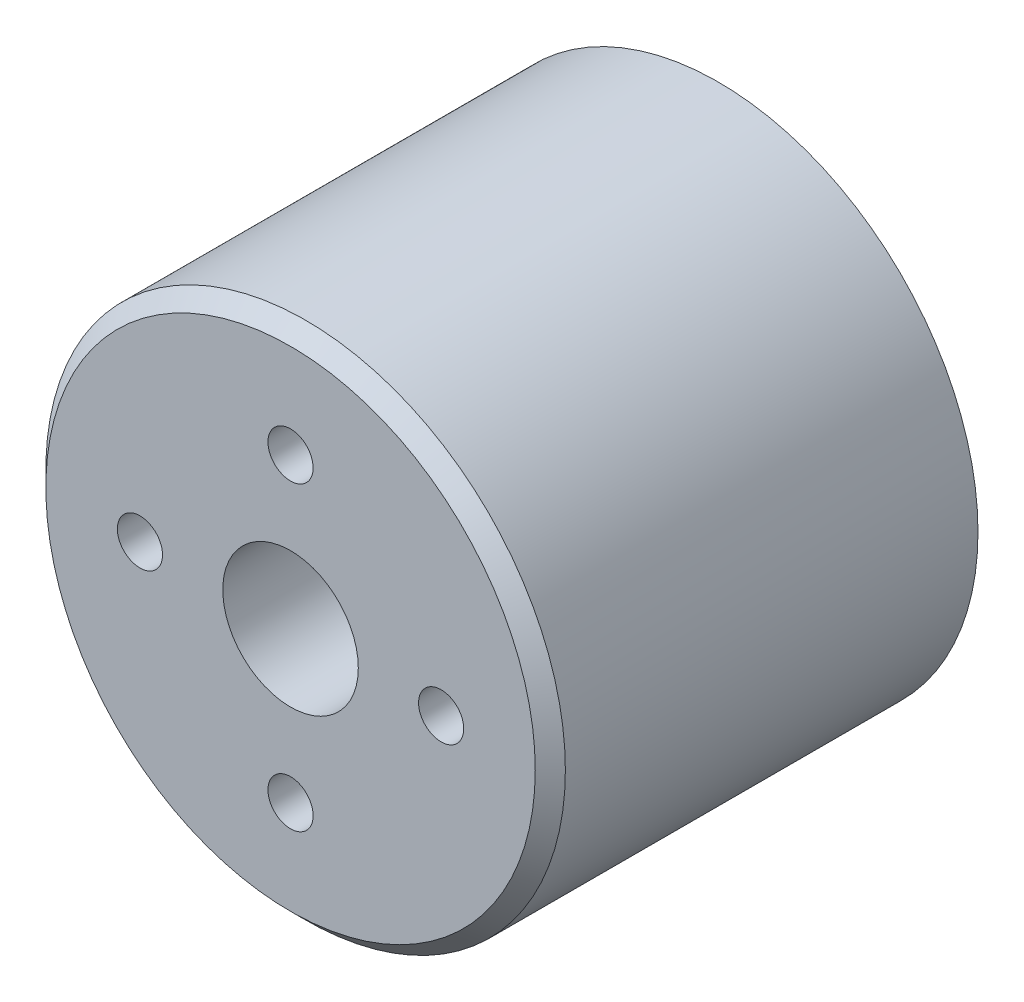
from build123d import *

# Parameters (mm, degrees)
ESQUISSE1_R             = 17.25
BOSS_EXTRU_1_DEPTH      = 28.4
CHANFREIN1_SIZE         = 1
ESQUISSE2_R             = 1.5
ESQUISSE2_R_2           = 1.25
ENL_V_MAT_EXTRU_1_DEPTH = 3
ENL_V_START             = -2.5
ESQUISSE3_R             = 1.5
ENL_V_MAT_EXTRU_2_DEPTH = 2.5
ESQUISSE4_R             = 4.5
ENL_V_MAT_EXTRU_4_DEPTH = 38.439083856


with BuildPart() as part:
    # Esquisse1 → Boss.-Extru.1 (new body)
    with BuildSketch(Plane.XY):
        Circle(ESQUISSE1_R)
    extrude(amount=BOSS_EXTRU_1_DEPTH)

    # Chanfrein1
    chanfrein1_edges = [part.edges().sort_by_distance(p)[0] for p in [
        (-17.25, 0, 28.4),
    ]]
    chamfer(chanfrein1_edges, length=CHANFREIN1_SIZE)

    # Esquisse2 → Enlèv. mat.-Extru.1 (cut)
    with BuildSketch(Plane(origin=(0, 0, 0), x_dir=(-1, 0, 0), z_dir=(0, 0, -1))):
        with Locations((8.660254038, 5)):
            Circle(ESQUISSE2_R)
        with Locations((0, -10)):
            Circle(ESQUISSE2_R)
        with Locations((-8.660254038, 5)):
            Circle(ESQUISSE2_R)
        with Locations((7.713223432, 13.359694875)):
            Circle(ESQUISSE2_R_2)
        with Locations((7.713223432, -13.359694875)):
            Circle(ESQUISSE2_R_2)
        with Locations((-15.426446864, 0)):
            Circle(ESQUISSE2_R_2)
    extrude(amount=-ENL_V_MAT_EXTRU_1_DEPTH, mode=Mode.SUBTRACT)

    # Esquisse3 → Enlèv. mat.-Extru.2 (cut)
    with BuildSketch(Plane.XY.offset(28.4).offset(ENL_V_START)):
        with Locations((0, 10)):
            Circle(ESQUISSE3_R)
        with Locations((10, 0)):
            Circle(ESQUISSE3_R)
        with Locations(Location((0, -10, 0), (0, 0, 180))):
            Circle(ESQUISSE3_R)
        with Locations((-10, 0)):
            Circle(ESQUISSE3_R)
    extrude(amount=ENL_V_MAT_EXTRU_2_DEPTH, mode=Mode.SUBTRACT)

    # Esquisse4 → Enlèv. mat.-Extru.4 (cut, through all)
    with BuildSketch(Plane.XY.offset(28.4)):
        Circle(ESQUISSE4_R)
    extrude(amount=-ENL_V_MAT_EXTRU_4_DEPTH, mode=Mode.SUBTRACT)


solid = part.part
